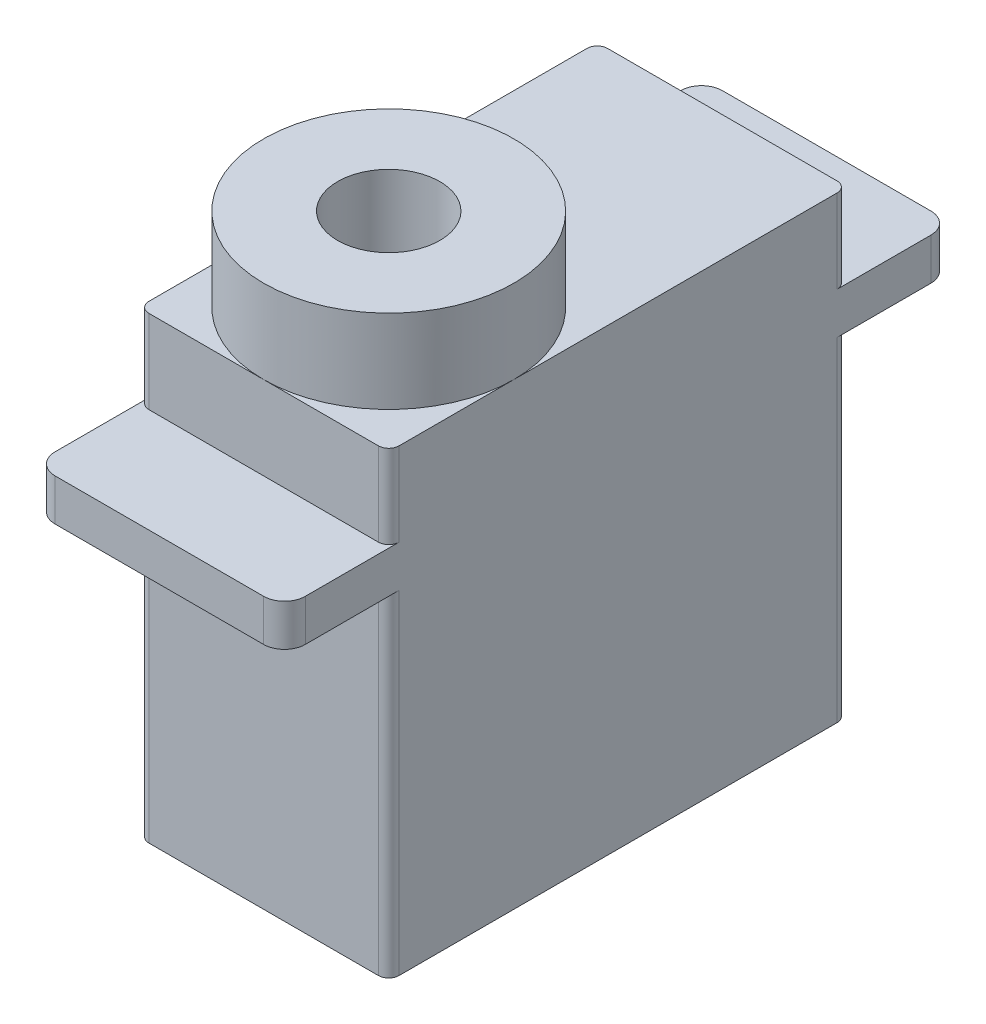
from build123d import *

# Parameters (mm, degrees)
SKETCH2_W           = 12
SKETCH2_H           = 22
BOSS_EXTRUDE1_DEPTH = 22
SKETCH3_R           = 6
SKETCH3_R_2         = 2.45
BOSS_EXTRUDE2_DEPTH = 4
SKETCH4_W           = 12
SKETCH4_H           = 2
BOSS_EXTRUDE3_DEPTH = 5
SKETCH5_W           = 12
SKETCH5_H           = 2
BOSS_EXTRUDE4_DEPTH = 5
FILLET1_R           = 1
FILLET2_R           = 0.5


with BuildPart() as part:
    # Sketch2 → Boss-Extrude1 (new body)
    with BuildSketch(Plane(origin=(0, 0, 0), x_dir=(1, 0, 0), z_dir=(0, 1, 0))):
        with Locations((6, -42.720930233)):
            Rectangle(SKETCH2_W, SKETCH2_H)
    extrude(amount=BOSS_EXTRUDE1_DEPTH)

    # Sketch3 → Boss-Extrude2 (add)
    with BuildSketch(Plane(origin=(0, 22, 0), x_dir=(1, 0, 0), z_dir=(0, 1, 0))):
        with Locations(Location((6, -47.720930233, 0), (0, 0, 270))):
            Circle(SKETCH3_R)
        with Locations(Location((6, -47.720930233, 0), (0, 0, 270))):
            Circle(SKETCH3_R_2, mode=Mode.SUBTRACT)
    extrude(amount=BOSS_EXTRUDE2_DEPTH)

    # Sketch4 → Boss-Extrude3 (add)
    with BuildSketch(Plane.XY.offset(53.720930233)):
        with Locations((6, 17)):
            Rectangle(SKETCH4_W, SKETCH4_H)
    extrude(amount=BOSS_EXTRUDE3_DEPTH)

    # Sketch5 → Boss-Extrude4 (add)
    with BuildSketch(Plane(origin=(0, 0, 31.720930233), x_dir=(-1, 0, 0), z_dir=(0, 0, -1))):
        with Locations((-6, 17)):
            Rectangle(SKETCH5_W, SKETCH5_H)
    extrude(amount=BOSS_EXTRUDE4_DEPTH)

    # Fillet1
    fillet1_edges = [part.edges().sort_by_distance(p)[0] for p in [
        (0, 17, 58.720930233),
        (12, 17, 58.720930233),
        (12, 17, 26.720930233),
        (0, 17, 26.720930233),
    ]]
    fillet(fillet1_edges, radius=FILLET1_R)

    # Fillet2
    fillet2_edges = [part.edges().sort_by_distance(p)[0] for p in [
        (12, 8, 53.720930233),
        (0, 8, 53.720930233),
        (0, 8, 31.720930233),
        (12, 8, 31.720930233),
        (0, 20, 31.720930233),
        (12, 20, 31.720930233),
        (12, 20, 53.720930233),
        (0, 20, 53.720930233),
    ]]
    fillet(fillet2_edges, radius=FILLET2_R)


solid = part.part
